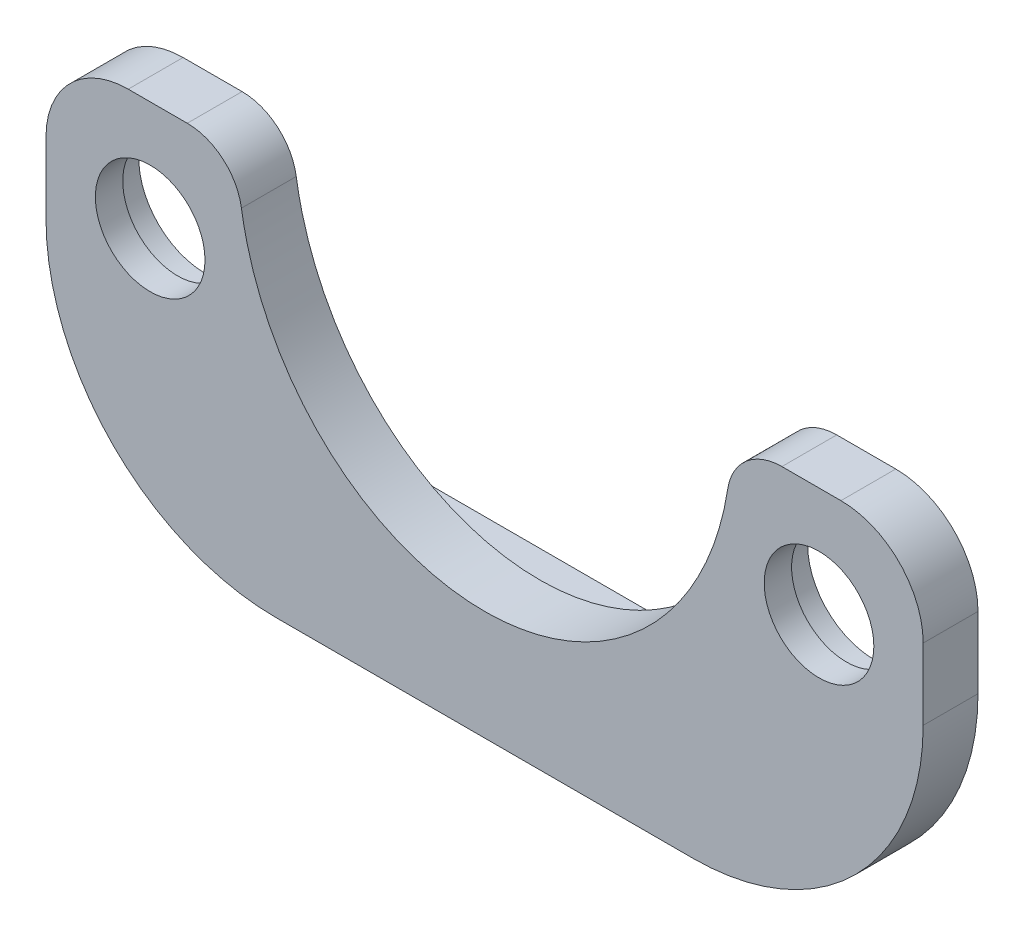
from build123d import *

# Parameters (mm, degrees)
SKETCH1_R           = 12.075
BOSS_EXTRUDE1_DEPTH = 10
BOSS_EXTRUDE2_START = -5
SKETCH2_R           = 12.075
SKETCH2_R_2         = 10
BOSS_EXTRUDE2_DEPTH = 5
SKETCH3_W           = 80
SKETCH3_H           = 5
BOSS_EXTRUDE3_DEPTH = 20
SKETCH4_R           = 2.575
CUT_EXTRUDE1_DEPTH  = 174.853386637


with BuildPart() as part:
    # Sketch1 → Boss-Extrude1 (new body)
    with BuildSketch(Plane.XY):
        with BuildLine():
            Line((134.231894093, 70), (145, 70))
            ThreePointArc((145, 70), (155.606601718, 65.606601718), (160, 55))
            Line((160, 55), (160, 42))
            ThreePointArc((160, 42), (147.69848481, 12.30151519), (118, 0))
            Line((118, 0), (42, 0))
            ThreePointArc((42, 0), (12.30151519, 12.30151519), (0, 42))
            Line((0, 42), (0, 55))
            ThreePointArc((0, 55), (4.393398282, 65.606601718), (15, 70))
            Line((15, 70), (25.768105907, 70))
            ThreePointArc((25.768105907, 70), (32.276192497, 67.592417858), (35.650528477, 61.528961786))
            add(Edge.make_bspline(
                [(35.650528477, 61.528961786), (42.075693473, 20), (80, 20), (117.924306527, 20), (124.349471523, 61.528961786)],
                knots=[4.882630888, 4.882630888, 4.882630888, 6.283185307, 6.283185307, 7.683739727, 7.683739727, 7.683739727], degree=2, weights=[1, 0.764663574, 1, 0.764663574, 1]))
            ThreePointArc((124.349471523, 61.528961786), (127.723807503, 67.592417858), (134.231894093, 70))
        make_face()
        with Locations((19, 50)):
            Circle(SKETCH1_R, mode=Mode.SUBTRACT)
        with Locations((141, 50)):
            Circle(SKETCH1_R, mode=Mode.SUBTRACT)
    extrude(amount=BOSS_EXTRUDE1_DEPTH)

    # Sketch2 → Boss-Extrude2 (add)
    # profile 1 of 2: a face of its own
    with BuildSketch(Plane.XY.offset(10).offset(BOSS_EXTRUDE2_START)):
        with Locations((141, 50)):
            Circle(SKETCH2_R)
        with Locations((141, 50)):
            Circle(SKETCH2_R_2, mode=Mode.SUBTRACT)
    # profile 2 of 2: a face of its own
    with BuildSketch(Plane.XY.offset(10).offset(BOSS_EXTRUDE2_START)):
        with Locations((19, 50)):
            Circle(SKETCH2_R)
        with Locations((19, 50)):
            Circle(SKETCH2_R_2, mode=Mode.SUBTRACT)
    extrude(amount=BOSS_EXTRUDE2_DEPTH)

    # Sketch3 → Boss-Extrude3 (add)
    with BuildSketch(Plane(origin=(0, 0, 0), x_dir=(-1, 0, 0), z_dir=(0, 0, -1))):
        with Locations((-80, 2.5)):
            Rectangle(SKETCH3_W, SKETCH3_H)
    extrude(amount=BOSS_EXTRUDE3_DEPTH)

    # Sketch4 → Cut-Extrude1 (cut, through all)
    with BuildSketch(Plane(origin=(0, 5, 0), x_dir=(1, 0, 0), z_dir=(0, 1, 0))):
        with Locations((100, 10)):
            Circle(SKETCH4_R)
        with Locations((60, 10)):
            Circle(SKETCH4_R)
    extrude(amount=-CUT_EXTRUDE1_DEPTH, mode=Mode.SUBTRACT)


solid = part.part
